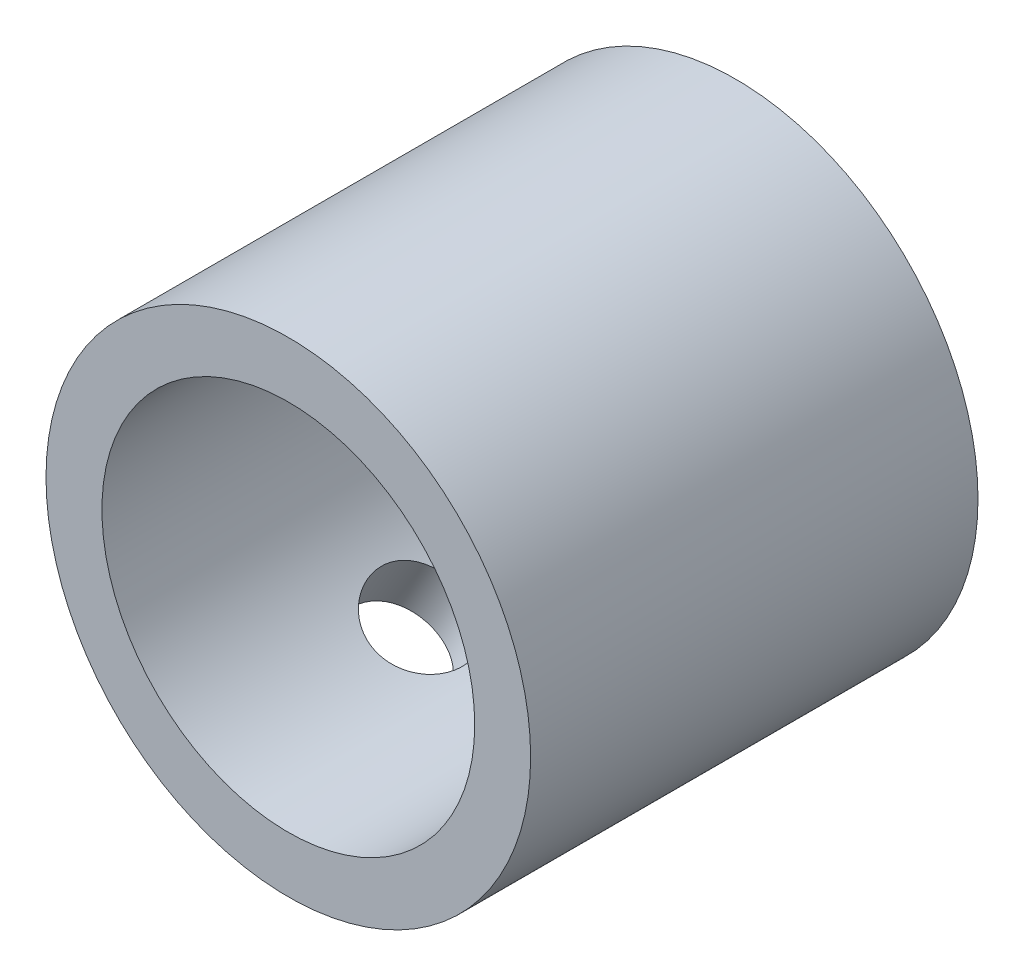
from build123d import *

# Parameters (mm, degrees)
SKETCH1_R           = 6.5
SKETCH1_R_2         = 5
BOSS_EXTRUDE1_DEPTH = 6


with BuildPart() as part:
    # Sketch1 → Boss-Extrude1 (new, symmetric)
    with BuildSketch(Plane.XY):
        Circle(SKETCH1_R)
        Circle(SKETCH1_R_2, mode=Mode.SUBTRACT)
    extrude(amount=BOSS_EXTRUDE1_DEPTH, both=True)

    # Sketch3 → Cut-Revolve1 (revolve, cut)
    with BuildSketch(Plane.XY):
        Polygon((-1.272458577, -2.203962906), (-3.798893917, -6.579877277), (-4.881425672, -5.954877277), (-2.354990332, -1.578962906), align=None)
    revolve(axis=Axis((-1.272458577, -2.203962906, 0), (-0.5000000000000009, -0.8660254037844382, 0)), mode=Mode.SUBTRACT)


solid = part.part
